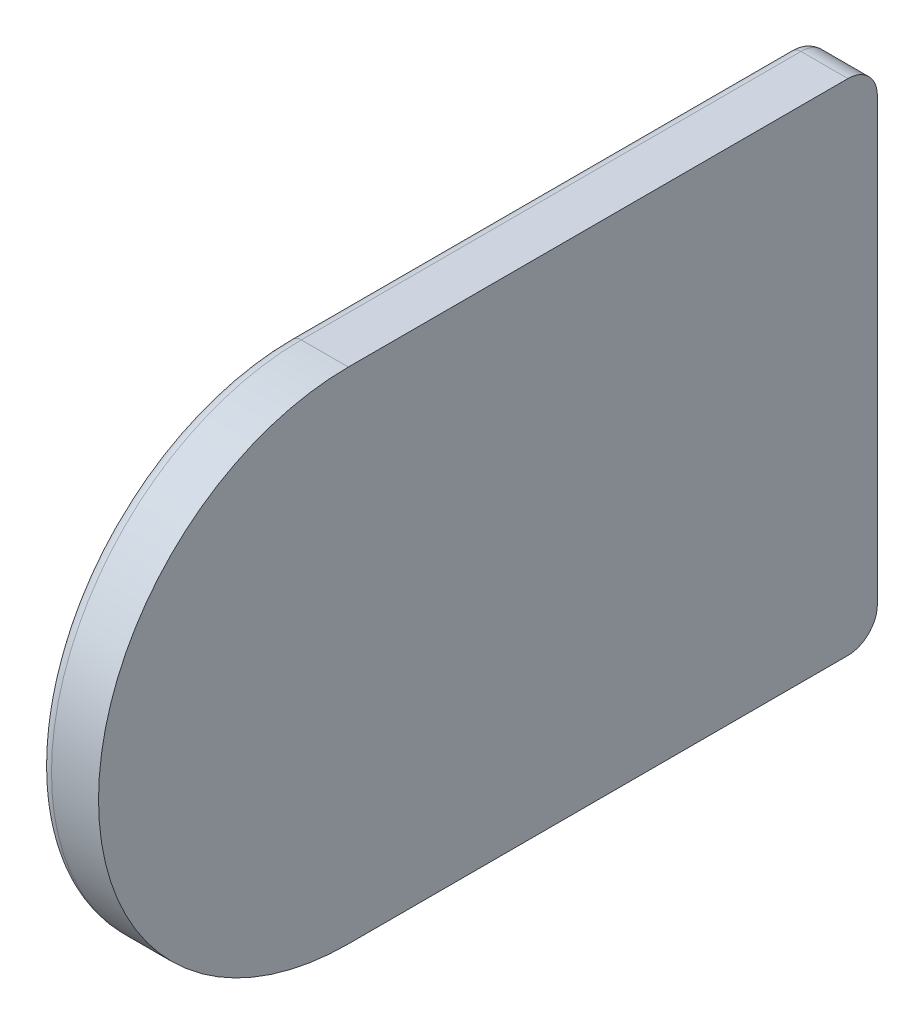
from build123d import *

# Parameters (mm, degrees)
BOSS_EXTRUDE1_DEPTH = 10
FILLET1_R           = 2
SKETCH2_W           = 21
SKETCH2_H           = 2.5
BOSS_EXTRUDE2_DEPTH = 20
SKETCH3_R           = 2.25
CUT_EXTRUDE1_DEPTH  = 108.274472732


with BuildPart() as part:
    # Sketch1 → Boss-Extrude1 (new body)
    with BuildSketch(Plane(origin=(0, 0, 0), x_dir=(0, 0, -1), z_dir=(1, 0, 0))):
        with BuildLine():
            Line((-45, -42.5), (40, -42.5))
            ThreePointArc((40, -42.5), (43.535533906, -41.035533906), (45, -37.5))
            Line((45, -37.5), (45, 37.5))
            ThreePointArc((45, 37.5), (43.535533906, 41.035533906), (40, 42.5))
            Line((40, 42.5), (-45, 42.5))
            ThreePointArc((-45, 42.5), (-87.5, 0), (-45, -42.5))
        make_face()
    extrude(amount=BOSS_EXTRUDE1_DEPTH)

    # Fillet1
    fillet1_edges = [part.edges().sort_by_distance(p)[0] for p in [
        (0, 42.5, 2.5),
        (0, 41.035533906, -43.535533906),
        (0, 0, -45),
        (0, -41.035533906, -43.535533906),
        (0, -42.5, 2.5),
        (0, 0, 87.5),
    ]]
    fillet(fillet1_edges, radius=FILLET1_R)

    # Sketch2 → Boss-Extrude2 (add)
    with BuildSketch(Plane.ZY):
        with Locations((12.5, 15)):
            Rectangle(SKETCH2_W, SKETCH2_H)
    boss_extrude2 = extrude(amount=BOSS_EXTRUDE2_DEPTH)

    # Mirror1: Boss-Extrude2 across plane
    add(boss_extrude2.mirror(Plane.ZX))

    # Sketch3 → Cut-Extrude1 (cut, through all)
    with BuildSketch(Plane(origin=(0, 16.25, 0), x_dir=(1, 0, 0), z_dir=(0, 1, 0))):
        with Locations(Location((-13, -12.5, 0), (0, 0, 270))):
            Circle(SKETCH3_R)
    extrude(amount=-CUT_EXTRUDE1_DEPTH, mode=Mode.SUBTRACT)


solid = part.part
